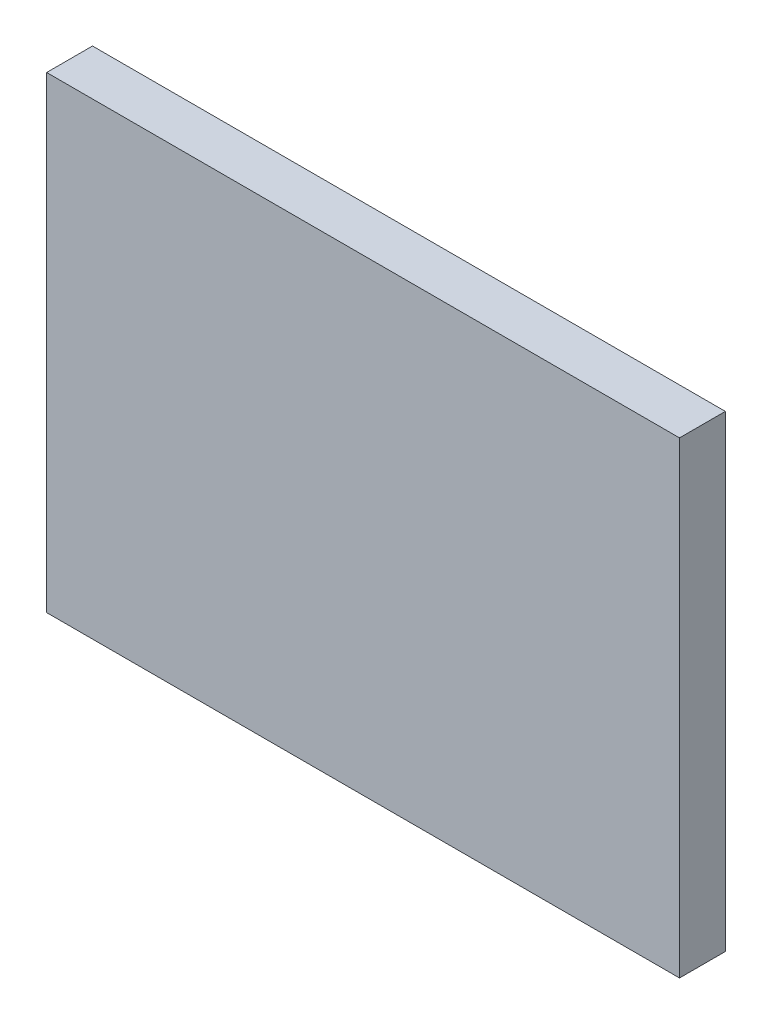
from build123d import *

# Parameters (mm, degrees)
ESQUISSE1_W      = 69
ESQUISSE1_H      = 51
EXTRUSION1_DEPTH = 5


with BuildPart() as part:
    # Esquisse1 → Extrusion1 (new body)
    with BuildSketch(Plane.XY):
        with Locations((-6.895817589, -5.23457898)):
            Rectangle(ESQUISSE1_W, ESQUISSE1_H)
    extrude(amount=EXTRUSION1_DEPTH)


solid = part.part
